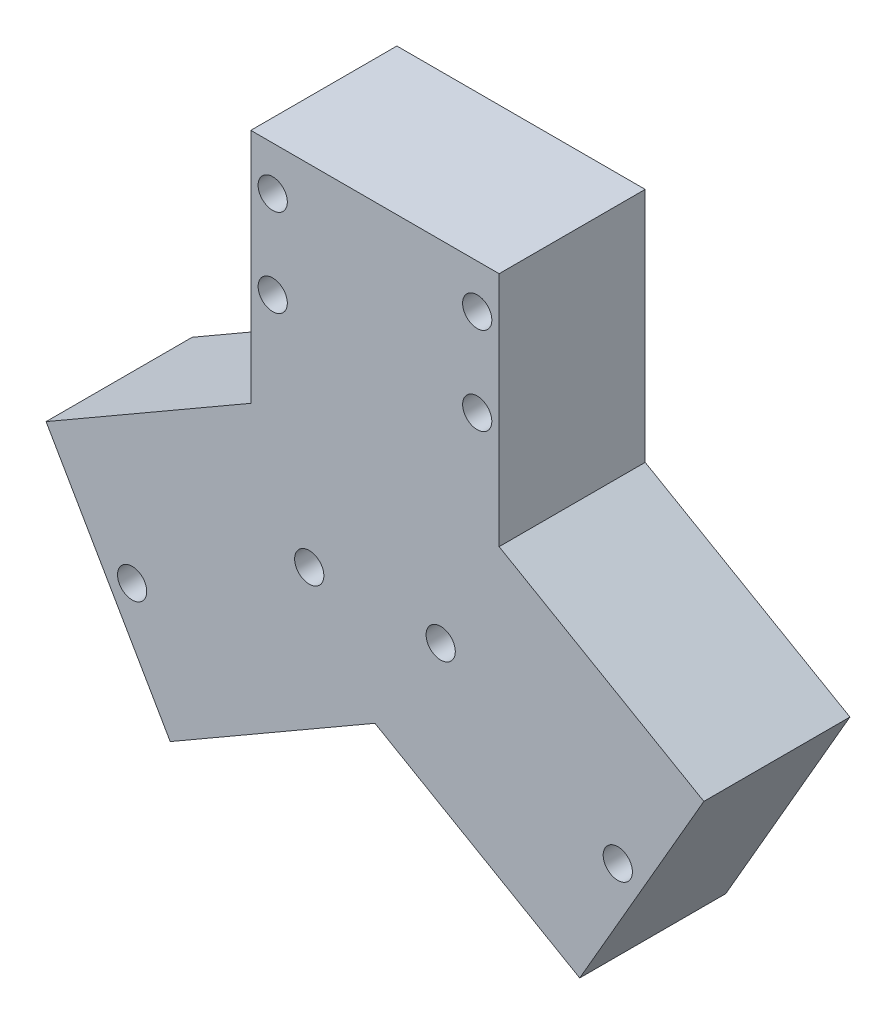
from build123d import *

# Parameters (mm, degrees)
SKETCH1_R           = 1
BOSS_EXTRUDE1_DEPTH = 10


with BuildPart() as part:
    # Sketch1 → Boss-Extrude1 (new body)
    with BuildSketch(Plane.XY):
        Polygon((-8.5, 14.722431864), (-8.5, 30.907477288), (8.5, 30.907477288), (8.5, 14.722431864), (22.516660498, 6.629909152), (14.016660498, -8.092522712), (0, 0), (-14.016660498, -8.092522712), (-22.516660498, 6.629909152), align=None)
        with Locations((-7, 27.907477288)):
            Circle(SKETCH1_R, mode=Mode.SUBTRACT)
        with Locations((7, 27.907477288)):
            Circle(SKETCH1_R, mode=Mode.SUBTRACT)
        with Locations((-7, 21.907477288)):
            Circle(SKETCH1_R, mode=Mode.SUBTRACT)
        with Locations((7, 21.907477288)):
            Circle(SKETCH1_R, mode=Mode.SUBTRACT)
        with Locations((-16.624355653, 0)):
            Circle(SKETCH1_R, mode=Mode.SUBTRACT)
        with Locations((-4.5, 7)):
            Circle(SKETCH1_R, mode=Mode.SUBTRACT)
        with Locations((4.5, 7)):
            Circle(SKETCH1_R, mode=Mode.SUBTRACT)
        with Locations((16.624355653, 0)):
            Circle(SKETCH1_R, mode=Mode.SUBTRACT)
    extrude(amount=BOSS_EXTRUDE1_DEPTH)


solid = part.part
